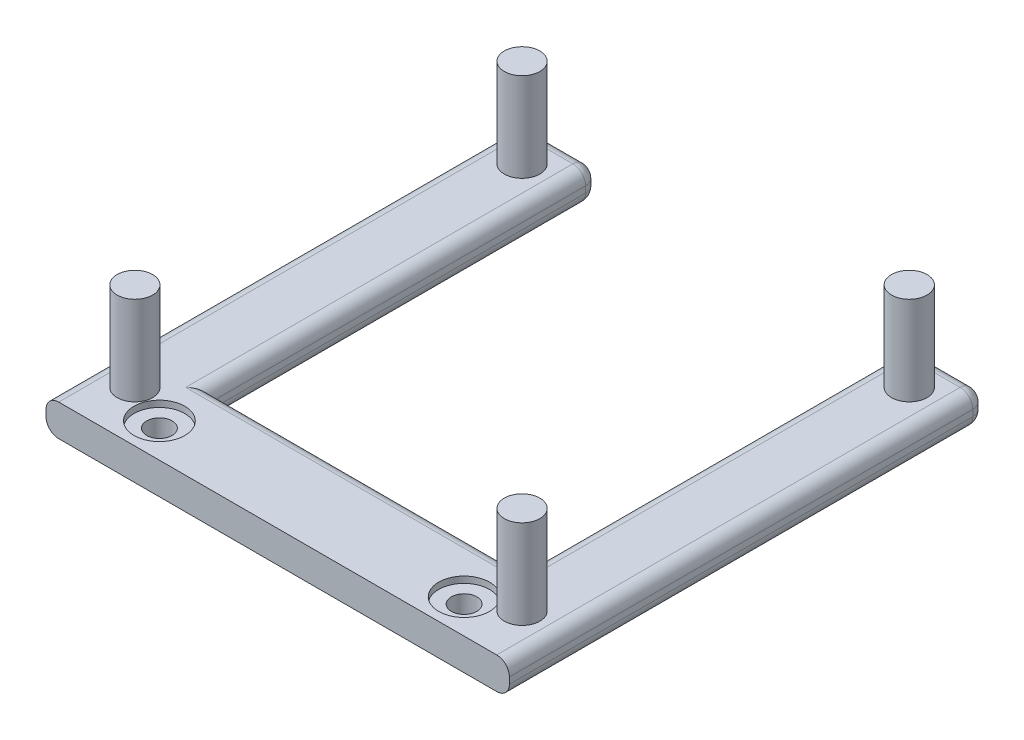
from build123d import *

# Parameters (mm, degrees)
SKETCH1_R               = 1.4
BOSS_EXTRUDE1_DEPTH     = 7
BOSS_EXTRUDE1_2_DEPTH   = 7
BOSS_EXTRUDE1_3_DEPTH   = 7
BOSS_EXTRUDE1_4_DEPTH   = 7
BOSS_EXTRUDE2_DEPTH     = 2.5
FILLET1_R               = 1
CUT_EXTRUDE1_DEPTH      = 28.434011737
CUT_EXTRUDE1_DEPTH_BACK = 28.434011737
SKETCH4_R               = 1
SKETCH5_R               = 2
CUT_EXTRUDE2_DEPTH      = 0.5


with BuildPart() as part:
    # Sketch1 → Boss-Extrude1 (new body)
    with BuildSketch(Plane(origin=(0, 0, 0), x_dir=(1, 0, 0), z_dir=(0, 1, 0))):
        with Locations(Location((-15.25, -15.25, 0), (0, 0, 270))):
            Circle(SKETCH1_R)
    extrude(amount=BOSS_EXTRUDE1_DEPTH)



with BuildPart() as body_2:
    # Sketch1 → Boss-Extrude1 2 (new body)
    with BuildSketch(Plane(origin=(0, 0, 0), x_dir=(1, 0, 0), z_dir=(0, 1, 0))):
        with Locations(Location((-15.25, 15.25, 0), (0, 0, 270))):
            Circle(SKETCH1_R)
    extrude(amount=BOSS_EXTRUDE1_2_DEPTH)


with BuildPart() as body_3:
    # Sketch1 → Boss-Extrude1 3 (new body)
    with BuildSketch(Plane(origin=(0, 0, 0), x_dir=(1, 0, 0), z_dir=(0, 1, 0))):
        with Locations(Location((15.25, 15.25, 0), (0, 0, 270))):
            Circle(SKETCH1_R)
    extrude(amount=BOSS_EXTRUDE1_3_DEPTH)


with BuildPart() as body_4:
    # Sketch1 → Boss-Extrude1 4 (new body)
    with BuildSketch(Plane(origin=(0, 0, 0), x_dir=(1, 0, 0), z_dir=(0, 1, 0))):
        with Locations(Location((15.25, -15.25, 0), (0, 0, 270))):
            Circle(SKETCH1_R)
    extrude(amount=BOSS_EXTRUDE1_4_DEPTH)


with BuildPart() as part_1:
    add(part.part)

    add(body_2.part)  # Boss-Extrude2 merges body 2

    add(body_3.part)  # Boss-Extrude2 merges body 3

    add(body_4.part)  # Boss-Extrude2 merges body 4
    # Sketch2 → Boss-Extrude2 (add)
    with BuildSketch(Plane.XZ):
        Polygon((-12.25, 12.25), (12.25, 12.25), (12.25, -18.25), (18.25, -18.25), (18.25, 19.25), (-18.25, 19.25), (-18.25, -18.25), (-12.25, -18.25), align=None)
    extrude(amount=BOSS_EXTRUDE2_DEPTH)

    # Fillet1
    fillet1_edges = [part_1.edges().sort_by_distance(p)[0] for p in [
        (-12.25, -2.5, -3),
        (0, -2.5, 12.25),
        (12.25, -2.5, -3),
        (15.25, -2.5, -18.25),
        (18.25, 0, 0.5),
        (18.25, -1.25, -18.25),
        (-18.25, 0, 0.5),
        (-15.25, 0, -18.25),
        (-18.25, -1.25, -18.25),
        (-12.25, 0, -3),
        (-12.25, -1.25, -18.25),
        (0, 0, 12.25),
        (12.25, 0, -3),
        (15.25, 0, -18.25),
        (12.25, -1.25, -18.25),
        (18.25, -2.5, 0.5),
        (-18.25, -2.5, 0.5),
        (-15.25, -2.5, -18.25),
    ]]
    fillet(fillet1_edges, radius=FILLET1_R)

    # Sketch4 → Cut-Extrude1 (cut, two sides: drawn at the far end of the back side and taken through both)
    with BuildSketch(Plane(origin=(0, 0, 0), x_dir=(1, 0, 0), z_dir=(0, 1, 0)).offset(-CUT_EXTRUDE1_DEPTH_BACK)):
        with Locations(Location((-12, -16.566325801, 0), (0, 0, 270))):
            Circle(SKETCH4_R)
        with Locations(Location((12, -16.566325801, 0), (0, 0, 270))):
            Circle(SKETCH4_R)
    extrude(amount=CUT_EXTRUDE1_DEPTH + CUT_EXTRUDE1_DEPTH_BACK, mode=Mode.SUBTRACT)

    # Sketch5 → Cut-Extrude2 (cut)
    with BuildSketch(Plane(origin=(0, 0, 0), x_dir=(1, 0, 0), z_dir=(0, 1, 0))):
        with Locations(Location((-12, -16.566325801, 0), (0, 0, 270))):
            Circle(SKETCH5_R)
        with Locations(Location((12, -16.566325801, 0), (0, 0, 270))):
            Circle(SKETCH5_R)
    extrude(amount=-CUT_EXTRUDE2_DEPTH, mode=Mode.SUBTRACT)


solid = part_1.part
